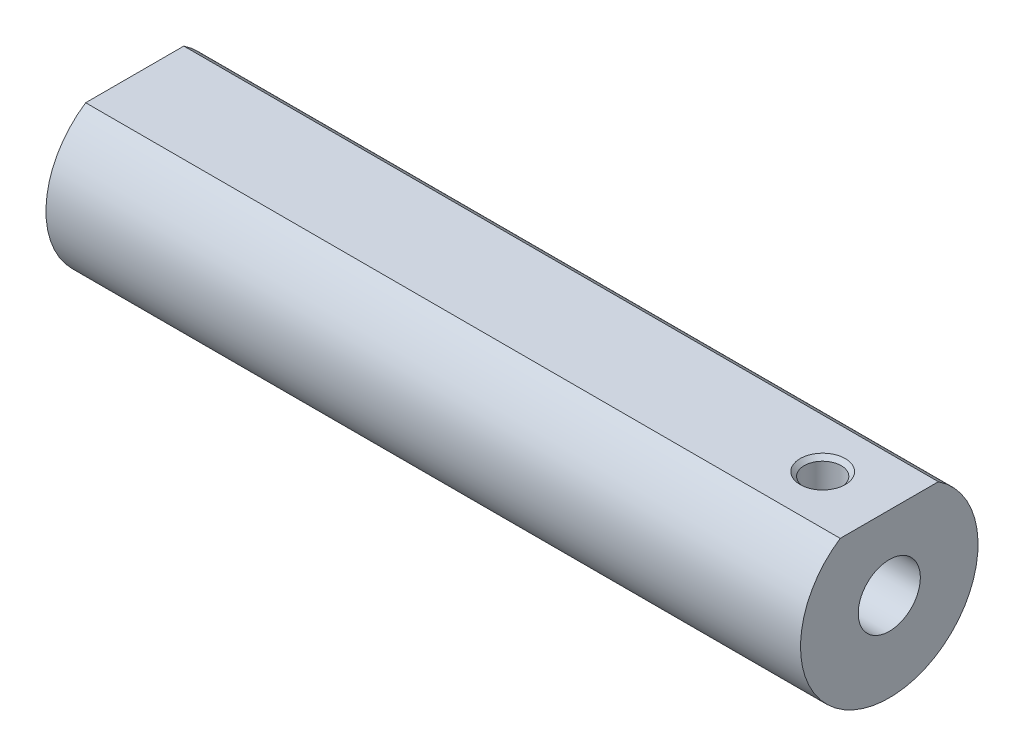
from build123d import *

# Parameters (mm, degrees)
SKETCH1_R                   = 6
BOSS_EXTRUDE1_DEPTH         = 51
CUT_EXTRUDE1_START          = -12
SKETCH2_R                   = 2.1
CUT_EXTRUDE1_DEPTH          = 12
M3_TAPPED_HOLE1_D           = 2.5
M3_TAPPED_HOLE1_DEPTH       = 6
M3_TAPPED_HOLE1_CSINK_D     = 3.05
M3_TAPPED_HOLE1_CSINK_ANGLE = 90
M3_TAPPED_HOLE1_TIP         = 0.751075774
CUT_EXTRUDE2_REACH          = 41.912


with BuildPart() as part:
    # Sketch1 → Boss-Extrude1 (new body)
    with BuildSketch(Plane(origin=(0, 0, 0), x_dir=(0, 0, -1), z_dir=(1, 0, 0))):
        Circle(SKETCH1_R)
    extrude(amount=BOSS_EXTRUDE1_DEPTH)

    # Sketch2 → Cut-Extrude1 (cut)
    with BuildSketch(Plane(origin=(51, 0, 0), x_dir=(0, 0, -1), z_dir=(1, 0, 0)).offset(CUT_EXTRUDE1_START)):
        Circle(SKETCH2_R)
        with BuildLine():
            Line((-3.31662479, 5), (3.31662479, 5))
            ThreePointArc((3.31662479, 5), (0, 6), (-3.31662479, 5))
        make_face()
    extrude(amount=CUT_EXTRUDE1_DEPTH, mode=Mode.SUBTRACT)

    # M3 Tapped Hole1
    with Locations(Plane(origin=(46.5, 5, 0), x_dir=(0, 0, 1), z_dir=(0, 1, 0))):
        with Locations((0, 0)):
            CounterSinkHole(M3_TAPPED_HOLE1_D / 2, M3_TAPPED_HOLE1_CSINK_D / 2, depth=M3_TAPPED_HOLE1_DEPTH, counter_sink_angle=M3_TAPPED_HOLE1_CSINK_ANGLE)
            with Locations((0, 0, -(M3_TAPPED_HOLE1_DEPTH + M3_TAPPED_HOLE1_TIP / 2))):  # 118° drill point
                Cone(0, M3_TAPPED_HOLE1_D / 2, M3_TAPPED_HOLE1_TIP, mode=Mode.SUBTRACT)

    # Sketch7 → Cut-Extrude2 (cut, up to next)
    with BuildSketch(Plane(origin=(39, 0, 0), x_dir=(0, 0, -1), z_dir=(1, 0, 0)), mode=Mode.PRIVATE) as cut_extrude2_sk1:
        with BuildLine():
            Line((-3.31662479, 5), (3.31662479, 5))
            ThreePointArc((3.31662479, 5), (0, 6), (-3.31662479, 5))
        make_face()
    cut_extrude2_tool1 = extrude(cut_extrude2_sk1.sketch, amount=-CUT_EXTRUDE2_REACH, mode=Mode.PRIVATE) & part.part
    add(cut_extrude2_tool1.solids().sort_by_distance((39, 5.403002, 0))[0], mode=Mode.SUBTRACT)


solid = part.part
